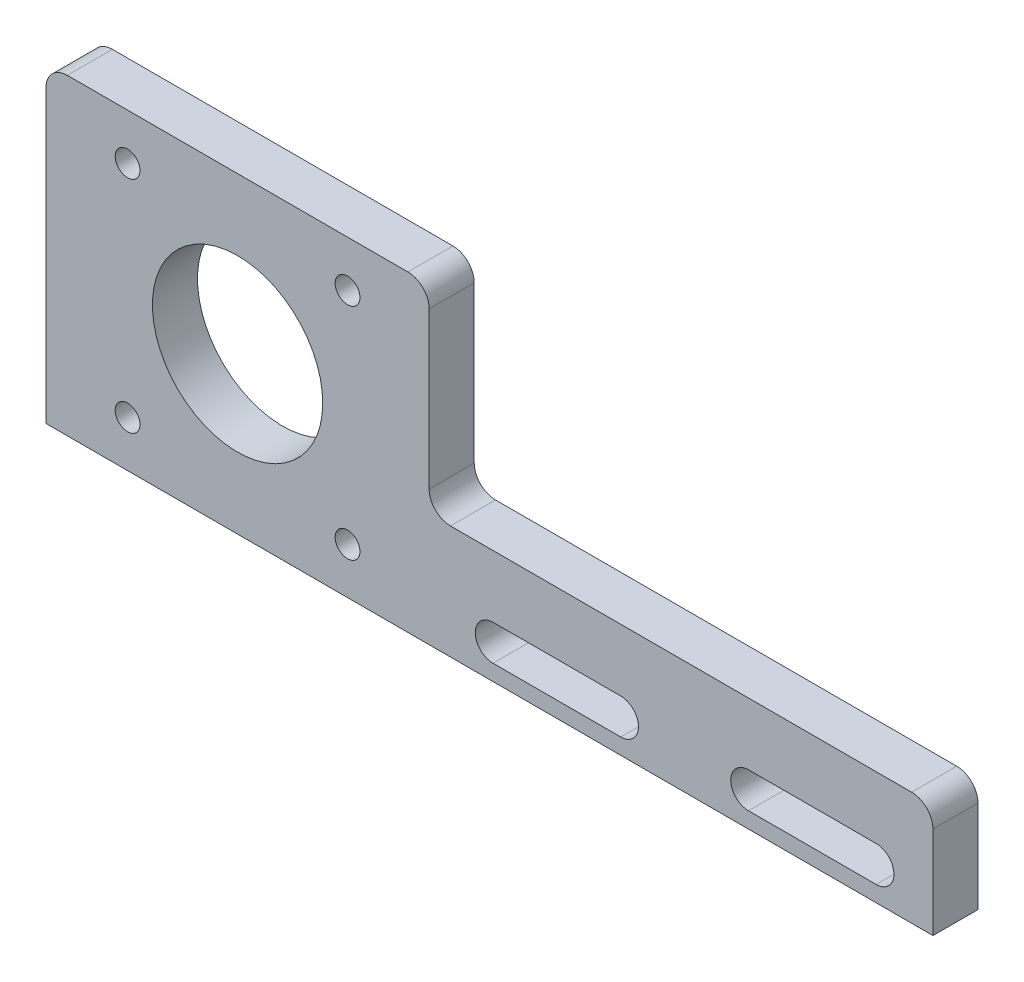
from build123d import *

# Parameters (mm, degrees)
CROQUIS2_R              = 1.75
CROQUIS2_R_2            = 12
SALIENTE_EXTRUIR1_DEPTH = 6.35
REDONDEO1_R             = 3


with BuildPart() as part:
    # Croquis2 → Saliente-Extruir1 (new body)
    with BuildSketch(Plane.XY):
        Polygon((-27.5, -30.5), (97.5, -30.5), (97.5, -14.5), (26.5, -14.5), (26.5, 13.5), (-27.5, 13.5), align=None)
        with Locations((-16, 7)):
            Circle(CROQUIS2_R, mode=Mode.SUBTRACT)
        with Locations((15, 7)):
            Circle(CROQUIS2_R, mode=Mode.SUBTRACT)
        with Locations((15, -24)):
            Circle(CROQUIS2_R, mode=Mode.SUBTRACT)
        with Locations((-16, -24)):
            Circle(CROQUIS2_R, mode=Mode.SUBTRACT)
        with Locations((-0.5, -8.5)):
            Circle(CROQUIS2_R_2, mode=Mode.SUBTRACT)
        with BuildLine():
            Line((71.5, -23.26), (89.5, -23.26))
            ThreePointArc((89.5, -23.26), (92, -25.76), (89.5, -28.26))
            Line((89.5, -28.26), (71.5, -28.26))
            ThreePointArc((71.5, -28.26), (69, -25.76), (71.5, -23.26))
        make_face(mode=Mode.SUBTRACT)
        with BuildLine():
            Line((53.5, -23.26), (35.5, -23.26))
            ThreePointArc((35.5, -23.26), (33, -25.76), (35.5, -28.26))
            Line((35.5, -28.26), (53.5, -28.26))
            ThreePointArc((53.5, -28.26), (56, -25.76), (53.5, -23.26))
        make_face(mode=Mode.SUBTRACT)
    extrude(amount=SALIENTE_EXTRUIR1_DEPTH)

    # Redondeo1
    redondeo1_edges = [part.edges().sort_by_distance(p)[0] for p in [
        (-27.5, 13.5, 3.175),
        (26.5, 13.5, 3.175),
        (26.5, -14.5, 3.175),
        (97.5, -14.5, 3.175),
    ]]
    fillet(redondeo1_edges, radius=REDONDEO1_R)


solid = part.part
